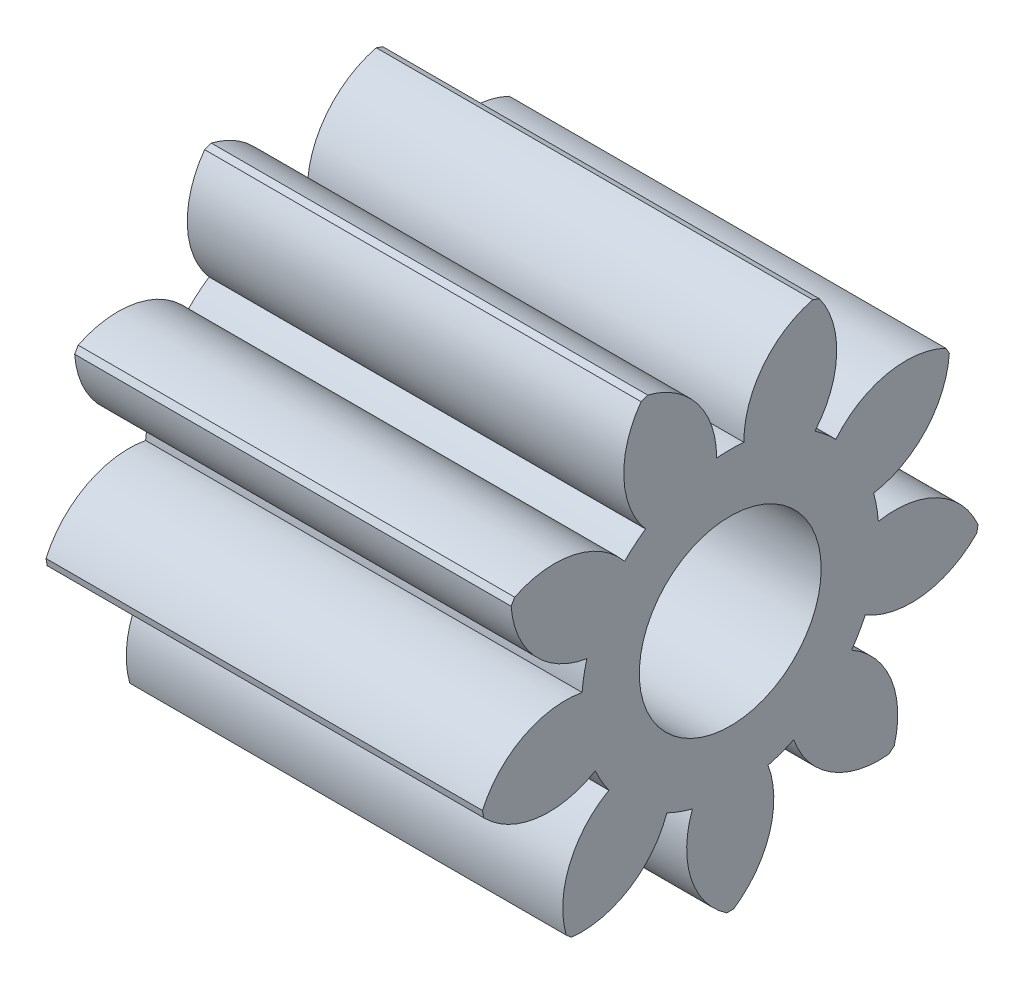
from build123d import *

# Parameters (mm, degrees)
BASPROSKE_W              = 12
BASPROSKE_H              = 6.9
TOOTHCUT_DEPTH           = 16.466738506
PATTERN_CIRCULAR_1_COUNT = 9
SKETCH_1_R               = 2.5
CUT_EXTRUDE_1_DEPTH      = 16.427377744
SCALE_1_SCALE            = 1.03


with BuildPart() as part:
    # BasProSke → Base-Revolve (revolve)
    with BuildSketch(Plane(origin=(0, 0, 0), x_dir=(1, 0, 0), z_dir=(0, 1, 0)), mode=Mode.PRIVATE) as base_revolve_sk:
        with Locations((6, 3.45)):
            Rectangle(BASPROSKE_W, BASPROSKE_H)
    revolve(base_revolve_sk.sketch.rotate(Axis((-10, 0, 0), (1, 0, 0)), 180), axis=Axis((-10, 0, 0), (1, 0, 0)))

    # TooCutSke → ToothCut (cut, through all)
    with BuildSketch(Plane(origin=(0, 0, 0), x_dir=(0, 0, -1), z_dir=(1, 0, 0))):
        with BuildLine():
            ThreePointArc((0.374882812, 4.069268377), (0, 4.0865), (-0.374882812, 4.069268377))
            ThreePointArc((-0.374882812, 4.069268377), (-0.912200879, 5.63954288), (-2.314462256, 6.527312978))
            ThreePointArc((-2.314462256, 6.527312978), (0, 6.9255), (2.314462256, 6.527312978))
            ThreePointArc((2.314462256, 6.527312978), (0.912200879, 5.63954288), (0.374882812, 4.069268377))
        make_face()
    toothcut = extrude(amount=TOOTHCUT_DEPTH, mode=Mode.SUBTRACT)

    # Круговой массив1: ToothCut ×9 about axis
    pattern_circular_1_axis = Axis((0, 0, 0), (1, 0, 0))
    for i in range(1, PATTERN_CIRCULAR_1_COUNT):
        add(toothcut.rotate(pattern_circular_1_axis, i * 360 / PATTERN_CIRCULAR_1_COUNT), mode=Mode.SUBTRACT)

    # Эскиз1 → Вырез-Вытянуть1 (cut, through all)
    with BuildSketch(Plane(origin=(12, 0, 0), x_dir=(0, 0, -1), z_dir=(1, 0, 0))):
        Circle(SKETCH_1_R)
    extrude(amount=-CUT_EXTRUDE_1_DEPTH, mode=Mode.SUBTRACT)


with BuildPart() as part_1:
    # Масштаб1: scaled about (6, 0, 0)
    add(part.part.scale(SCALE_1_SCALE).moved(Location((-0.18, 0, 0))))


solid = part_1.part
